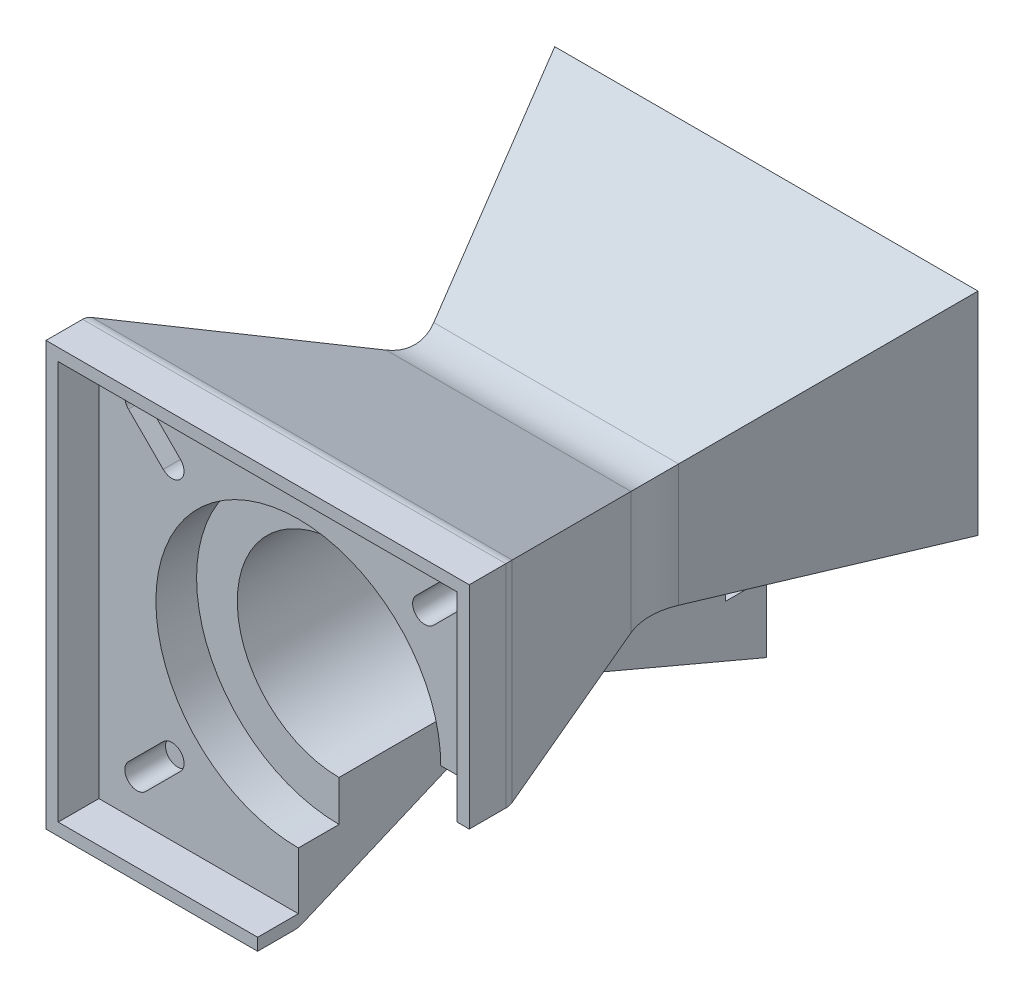
from build123d import *

# Parameters (mm, degrees)
SKETCH1_W           = 104
SKETCH1_H           = 104
BOSS_EXTRUDE1_DEPTH = 57.5
BOSS_EXTRUDE1_TAPER = 23
SKETCH2_R           = 25
CUT_EXTRUDE1_DEPTH  = 187.70029459
SKETCH3_R           = 35
SKETCH3_R_2         = 25
CUT_EXTRUDE2_DEPTH  = 10
CUT_EXTRUDE3_START  = -10
SKETCH4_R           = 35
CUT_EXTRUDE3_DEPTH  = 10
SKETCH5_W           = 52
SKETCH5_H           = 52
CUT_EXTRUDE4_DEPTH  = 187.70029459
FILLET1_R           = 15
BOSS_EXTRUDE2_DEPTH = 10
CUT_EXTRUDE5_DEPTH  = 10
FILLET2_R           = 5


with BuildPart() as part:
    # Sketch1 → Boss-Extrude1 (new body)
    with BuildSketch(Plane.XY):
        with Locations((52, 52)):
            Rectangle(SKETCH1_W, SKETCH1_H)
    boss_extrude1 = extrude(amount=BOSS_EXTRUDE1_DEPTH, taper=BOSS_EXTRUDE1_TAPER)

    # Mirror1: Boss-Extrude1 across plane
    add(boss_extrude1.mirror(Plane.XY.offset(57.5)))

    # Sketch2 → Cut-Extrude1 (cut, through all)
    with BuildSketch(Plane.XY.offset(115)):
        with Locations((52, 52)):
            Circle(SKETCH2_R)
    extrude(amount=-CUT_EXTRUDE1_DEPTH, mode=Mode.SUBTRACT)

    # Sketch3 → Cut-Extrude2 (cut)
    with BuildSketch(Plane.XY.offset(115)):
        with Locations((52, 52)):
            Circle(SKETCH3_R)
        with Locations((52, 52)):
            Circle(SKETCH3_R_2, mode=Mode.SUBTRACT)
    extrude(amount=-CUT_EXTRUDE2_DEPTH, mode=Mode.SUBTRACT)

    # Sketch4 → Cut-Extrude3 (cut)
    with BuildSketch(Plane(origin=(0, 0, 0), x_dir=(-1, 0, 0), z_dir=(0, 0, -1)).offset(CUT_EXTRUDE3_START)):
        with Locations(Location((-52, 52, 0), (0, 0, 180))):
            Circle(SKETCH4_R)
    extrude(amount=CUT_EXTRUDE3_DEPTH, mode=Mode.SUBTRACT)

    # Sketch5 → Cut-Extrude4 (cut, through all)
    with BuildSketch(Plane.XY.offset(115)):
        with Locations((78, 26)):
            Rectangle(SKETCH5_W, SKETCH5_H)
    extrude(amount=-CUT_EXTRUDE4_DEPTH, mode=Mode.SUBTRACT)

    # Fillet1
    fillet1_edges = [part.edges().sort_by_distance(p)[0] for p in [
        (52, 79.592698068, 57.5),
        (24.407301932, 52, 57.5),
        (79.592698068, 65.796349034, 57.5),
        (38.203650966, 24.407301932, 57.5),
    ]]
    fillet(fillet1_edges, radius=FILLET1_R)

    # Sketch6 → Boss-Extrude2 (add)
    with BuildSketch(Plane.XY.offset(115)):
        Polygon((52, 0), (52, 3), (3, 3), (3, 101), (101, 101), (101, 52), (104, 52), (104, 104), (0, 104), (0, 0), align=None)
    extrude(amount=BOSS_EXTRUDE2_DEPTH)

    # Sketch7 → Cut-Extrude5 (cut)
    with BuildSketch(Plane.XY.offset(115)):
        with BuildLine():
            Line((10.251025223, 89.50633409), (14.587037586, 85.170321726))
            ThreePointArc((14.587037586, 85.170321726), (16.644660941, 87.355339059), (18.829678274, 89.412962414))
            Line((18.829678274, 89.412962414), (14.49366591, 93.748974777))
            ThreePointArc((14.49366591, 93.748974777), (10.251025223, 93.748974777), (10.251025223, 89.50633409))
        make_face()
        with BuildLine():
            Line((14.587037586, 85.170321726), (18.795655971, 80.961703342))
            ThreePointArc((18.795655971, 80.961703342), (23.038296658, 80.961703342), (23.038296658, 85.204344029))
            Line((23.038296658, 85.204344029), (18.829678274, 89.412962414))
            ThreePointArc((18.829678274, 89.412962414), (16.644660941, 87.355339059), (14.587037586, 85.170321726))
        make_face()
        with BuildLine():
            ThreePointArc((18.829678274, 14.587037586), (16.644660941, 16.644660941), (14.587037586, 18.829678274))
            Line((14.587037586, 18.829678274), (10.251025223, 14.49366591))
            ThreePointArc((10.251025223, 14.49366591), (10.251025223, 10.251025223), (14.49366591, 10.251025223))
            Line((14.49366591, 10.251025223), (18.829678274, 14.587037586))
        make_face()
        with BuildLine():
            Line((18.795655971, 23.038296658), (14.587037586, 18.829678274))
            ThreePointArc((14.587037586, 18.829678274), (16.644660941, 16.644660941), (18.829678274, 14.587037586))
            Line((18.829678274, 14.587037586), (23.038296658, 18.795655971))
            ThreePointArc((23.038296658, 18.795655971), (23.038296658, 23.038296658), (18.795655971, 23.038296658))
        make_face()
        with BuildLine():
            ThreePointArc((89.412962414, 85.170321726), (87.355339059, 87.355339059), (85.170321726, 89.412962414))
            Line((85.170321726, 89.412962414), (80.961703342, 85.204344029))
            ThreePointArc((80.961703342, 85.204344029), (80.961703342, 80.961703342), (85.204344029, 80.961703342))
            Line((85.204344029, 80.961703342), (89.412962414, 85.170321726))
        make_face()
        with BuildLine():
            Line((89.50633409, 93.748974777), (85.170321726, 89.412962414))
            ThreePointArc((85.170321726, 89.412962414), (87.355339059, 87.355339059), (89.412962414, 85.170321726))
            Line((89.412962414, 85.170321726), (93.748974777, 89.50633409))
            ThreePointArc((93.748974777, 89.50633409), (93.748974777, 93.748974777), (89.50633409, 93.748974777))
        make_face()
    extrude(amount=-CUT_EXTRUDE5_DEPTH, mode=Mode.SUBTRACT)

    # Fillet2
    fillet2_edges = [part.edges().sort_by_distance(p)[0] for p in [
        (0, 52, 115),
        (26, 0, 115),
        (52, 104, 115),
        (104, 78, 115),
    ]]
    fillet(fillet2_edges, radius=FILLET2_R)


solid = part.part
